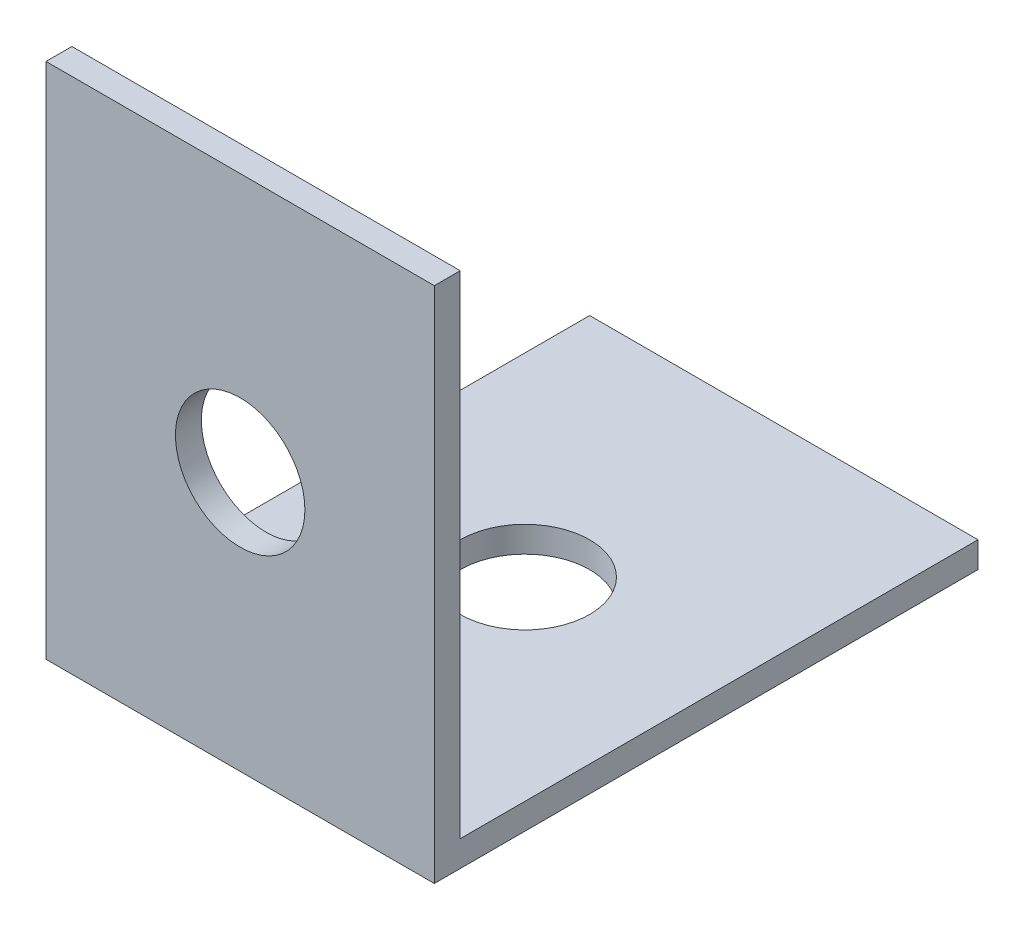
from build123d import *

# Parameters (mm, degrees)
SKETCH1_W           = 15
SKETCH1_H           = 20
SKETCH1_R           = 2.5
BOSS_EXTRUDE1_DEPTH = 1
SKETCH2_W           = 15
SKETCH2_H           = 20
SKETCH2_R           = 2.5
BOSS_EXTRUDE2_DEPTH = 1


with BuildPart() as part:
    # Sketch1 → Boss-Extrude1 (new body)
    with BuildSketch(Plane(origin=(0, 0, 0), x_dir=(1, 0, 0), z_dir=(0, 1, 0))):
        Rectangle(SKETCH1_W, SKETCH1_H)
        with Locations(Location((0, 0, 0), (0, 0, 270))):
            Circle(SKETCH1_R, mode=Mode.SUBTRACT)
    extrude(amount=BOSS_EXTRUDE1_DEPTH)

    # Sketch2 → Boss-Extrude2 (add)
    with BuildSketch(Plane.XY.offset(10)):
        with Locations((0, 10)):
            Rectangle(SKETCH2_W, SKETCH2_H)
        with Locations((0, 10)):
            Circle(SKETCH2_R, mode=Mode.SUBTRACT)
    extrude(amount=BOSS_EXTRUDE2_DEPTH)


solid = part.part
